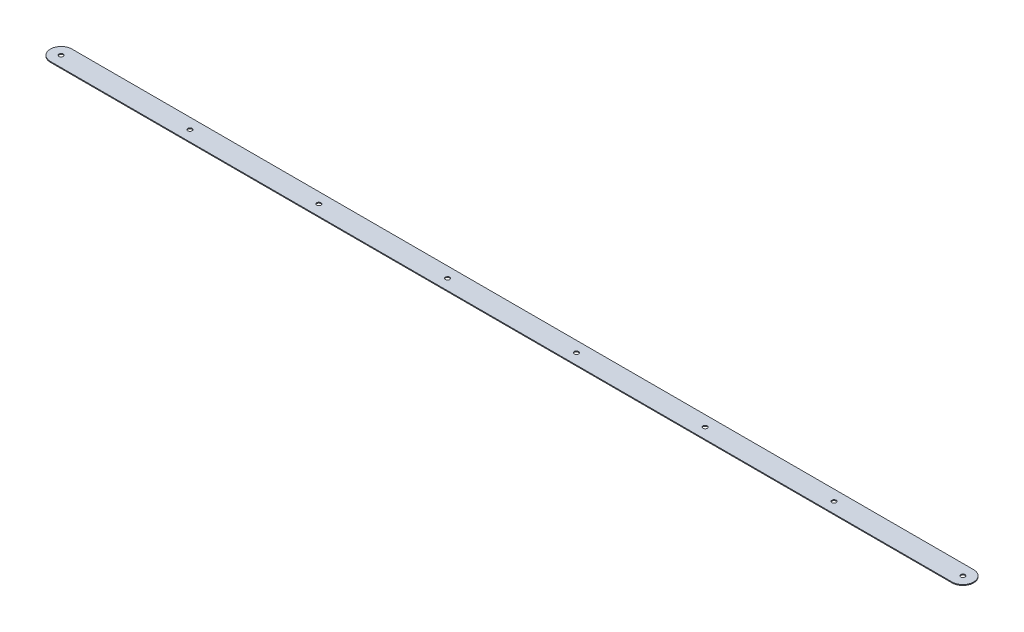
from build123d import *

# Parameters (mm, degrees)
SKETCH1_R           = 2.5
BOSS_EXTRUDE1_DEPTH = 1


with BuildPart() as part:
    # Sketch1 → Boss-Extrude1 (new body)
    with BuildSketch(Plane(origin=(0, 0, 0), x_dir=(1, 0, 0), z_dir=(0, 1, 0))):
        with BuildLine():
            Line((0, 12.5), (1050, 12.5))
            ThreePointArc((1050, 12.5), (1062.5, 0), (1050, -12.5))
            Line((1050, -12.5), (0, -12.5))
            ThreePointArc((0, -12.5), (-12.5, 0), (0, 12.5))
        make_face()
        with Locations(Location((0, 0, 0), (0, 0, 270))):
            Circle(SKETCH1_R, mode=Mode.SUBTRACT)
        with Locations(Location((150, 0, 0), (0, 0, 270))):
            Circle(SKETCH1_R, mode=Mode.SUBTRACT)
        with Locations(Location((300, 0, 0), (0, 0, 270))):
            Circle(SKETCH1_R, mode=Mode.SUBTRACT)
        with Locations(Location((450, 0, 0), (0, 0, 270))):
            Circle(SKETCH1_R, mode=Mode.SUBTRACT)
        with Locations(Location((600, 0, 0), (0, 0, 270))):
            Circle(SKETCH1_R, mode=Mode.SUBTRACT)
        with Locations(Location((750, 0, 0), (0, 0, 270))):
            Circle(SKETCH1_R, mode=Mode.SUBTRACT)
        with Locations(Location((900, 0, 0), (0, 0, 270))):
            Circle(SKETCH1_R, mode=Mode.SUBTRACT)
        with Locations(Location((1050, 0, 0), (0, 0, 270))):
            Circle(SKETCH1_R, mode=Mode.SUBTRACT)
    extrude(amount=BOSS_EXTRUDE1_DEPTH)


solid = part.part
